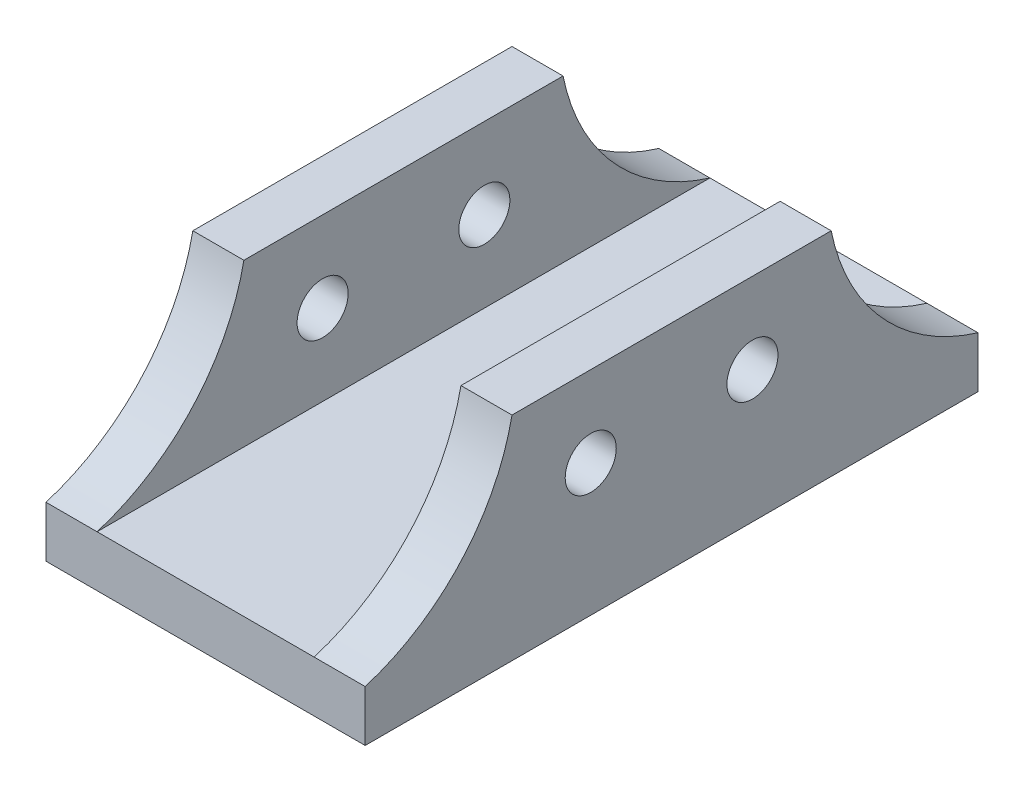
from build123d import *

# Parameters (mm, degrees)
SKETCH1_W           = 144
SKETCH1_H           = 50
SKETCH1_R           = 6
BOSS_EXTRUDE1_DEPTH = 37.5
SKETCH2_W           = 51
SKETCH2_H           = 38
CUT_EXTRUDE1_DEPTH  = 157.978501713
CUT_EXTRUDE2_DEPTH  = 116.364639296


with BuildPart() as part:
    # Sketch1 → Boss-Extrude1 (new, symmetric)
    with BuildSketch(Plane(origin=(0, 0, 0), x_dir=(0, 0, -1), z_dir=(1, 0, 0))):
        with Locations((0, 25)):
            Rectangle(SKETCH1_W, SKETCH1_H)
        with Locations((-19, 31)):
            Circle(SKETCH1_R, mode=Mode.SUBTRACT)
        with Locations(Location((19, 31, 0), (0, 0, 180))):
            Circle(SKETCH1_R, mode=Mode.SUBTRACT)
    extrude(amount=BOSS_EXTRUDE1_DEPTH, both=True)

    # Sketch2 → Cut-Extrude1 (cut, through all)
    with BuildSketch(Plane.XY.offset(72)):
        with Locations((0, 31)):
            Rectangle(SKETCH2_W, SKETCH2_H)
    extrude(amount=-CUT_EXTRUDE1_DEPTH, mode=Mode.SUBTRACT)

    # Sketch3 → Cut-Extrude2 (cut, through all)
    with BuildSketch(Plane(origin=(37.5, 0, 0), x_dir=(0, 0, -1), z_dir=(1, 0, 0))):
        with BuildLine():
            Line((72, 12), (72, 50))
            Line((72, 50), (37.5, 50))
            ThreePointArc((37.5, 50), (49.502162082, 26.235515574), (72, 12))
        make_face()
        with BuildLine():
            Line((-72, 50), (-37.5, 50))
            ThreePointArc((-37.5, 50), (-49.502162082, 26.235515574), (-72, 12))
            Line((-72, 12), (-72, 50))
        make_face()
    extrude(amount=-CUT_EXTRUDE2_DEPTH, mode=Mode.SUBTRACT)


solid = part.part
